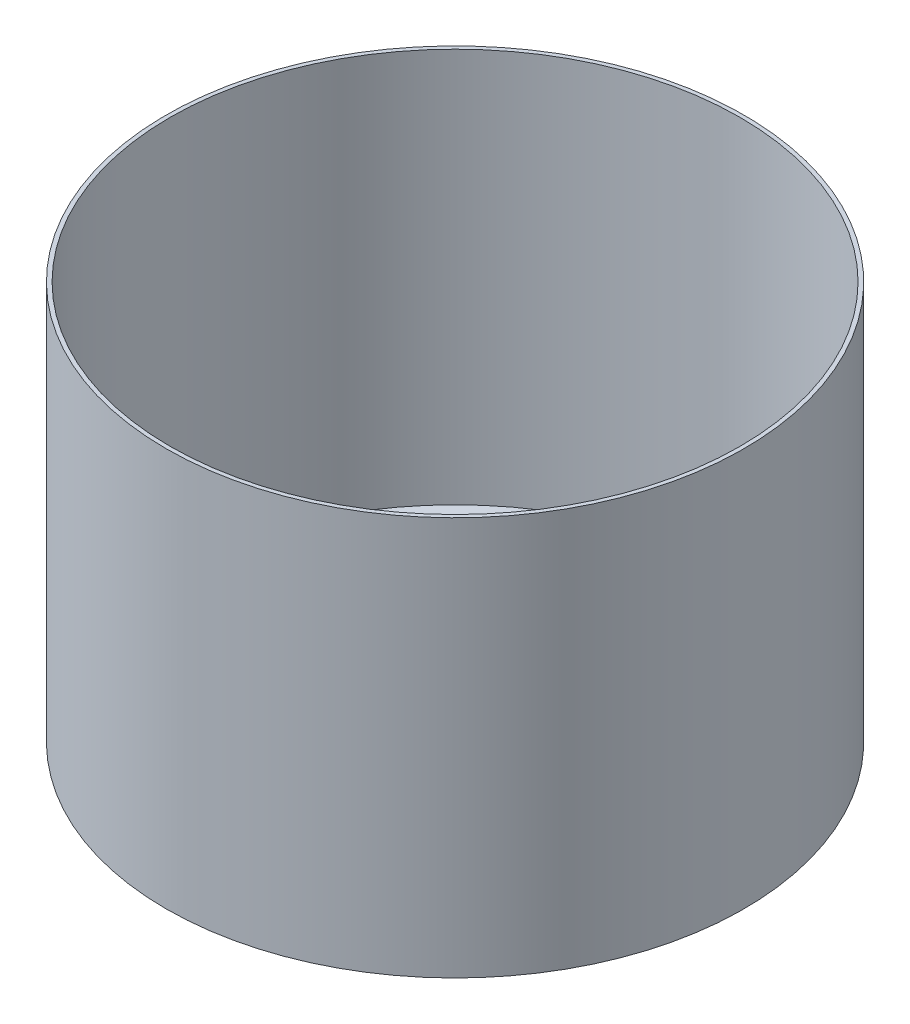
from build123d import *

# Parameters (mm, degrees)
SKETCH_6_R      = 71.5
SKETCH_6_R_2    = 2
EXTRUDE_2_DEPTH = 1
SKETCH_6_7_R    = 72.5
SKETCH_6_7_R_2  = 71.5
EXTRUDE_3_DEPTH = 100


with BuildPart() as part:
    # 草圖6 → 填料-伸長2 (new body)
    with BuildSketch(Plane(origin=(0, 0, 0), x_dir=(1, 0, 0), z_dir=(0, 1, 0))):
        Circle(SKETCH_6_R)
        with Locations((0, -5)):
            Circle(SKETCH_6_R_2, mode=Mode.SUBTRACT)
        with Locations((-5, 0)):
            Circle(SKETCH_6_R_2, mode=Mode.SUBTRACT)
        with Locations((5, 0)):
            Circle(SKETCH_6_R_2, mode=Mode.SUBTRACT)
        with Locations((0, 5)):
            Circle(SKETCH_6_R_2, mode=Mode.SUBTRACT)
    extrude(amount=EXTRUDE_2_DEPTH)

    # 草圖6<7> → 填料-伸長3 (add)
    with BuildSketch(Plane(origin=(0, 0, 0), x_dir=(1, 0, 0), z_dir=(0, 1, 0))):
        Circle(SKETCH_6_7_R)
        Circle(SKETCH_6_7_R_2, mode=Mode.SUBTRACT)
    extrude(amount=EXTRUDE_3_DEPTH)


solid = part.part
